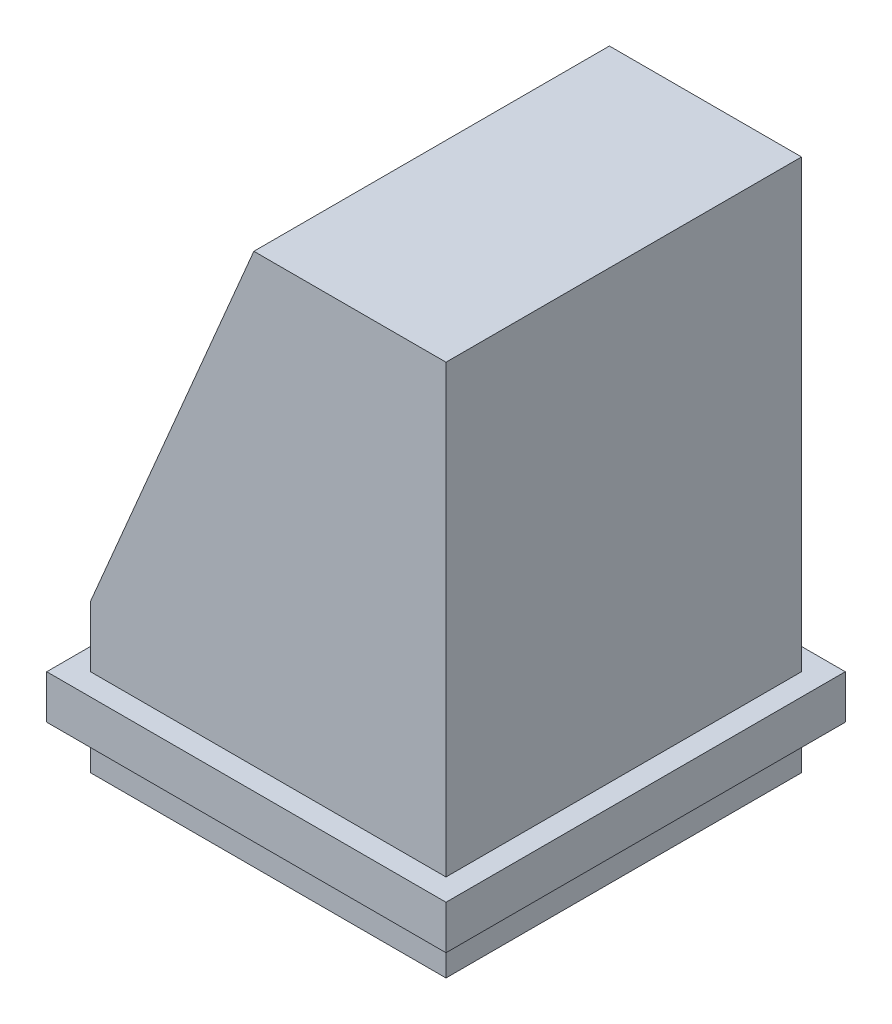
from build123d import *

# Parameters (mm, degrees)
SKETCH2_W           = 812.8
SKETCH2_H           = 812.8
BOSS_EXTRUDE1_DEPTH = 1219.2
SKETCH3_W           = 912.8
SKETCH3_H           = 912.8
SKETCH3_W_2         = 812.8
SKETCH3_H_2         = 812.8
BOSS_EXTRUDE2_DEPTH = 100
CHAMFER4_SIZE       = 880
CHAMFER4_SIZE2      = 373.537838264


with BuildPart() as part:
    # Sketch2 → Boss-Extrude1 (new body)
    with BuildSketch(Plane(origin=(0, 0, 0), x_dir=(1, 0, 0), z_dir=(0, 1, 0))):
        with Locations((406.4, 406.4)):
            Rectangle(SKETCH2_W, SKETCH2_H)
    extrude(amount=BOSS_EXTRUDE1_DEPTH)

    # Sketch3 → Boss-Extrude2 (add)
    with BuildSketch(Plane(origin=(0, 100, 0), x_dir=(1, 0, 0), z_dir=(0, 1, 0))):
        with Locations((406.4, 406.4)):
            Rectangle(SKETCH3_W, SKETCH3_H)
        with Locations((406.4, 406.4)):
            Rectangle(SKETCH3_W_2, SKETCH3_H_2, mode=Mode.SUBTRACT)
    extrude(amount=BOSS_EXTRUDE2_DEPTH)

    # Chamfer4
    chamfer4_edges = [part.edges().sort_by_distance(p)[0] for p in [
        (0, 1219.2, -406.4),
    ]]
    chamfer4_side = [part.faces().sort_by_distance(p)[0] for p in [
        (0, 709.6, -406.4),
    ]]
    chamfer(chamfer4_edges, length=CHAMFER4_SIZE, length2=CHAMFER4_SIZE2, reference=chamfer4_side[0])


solid = part.part
